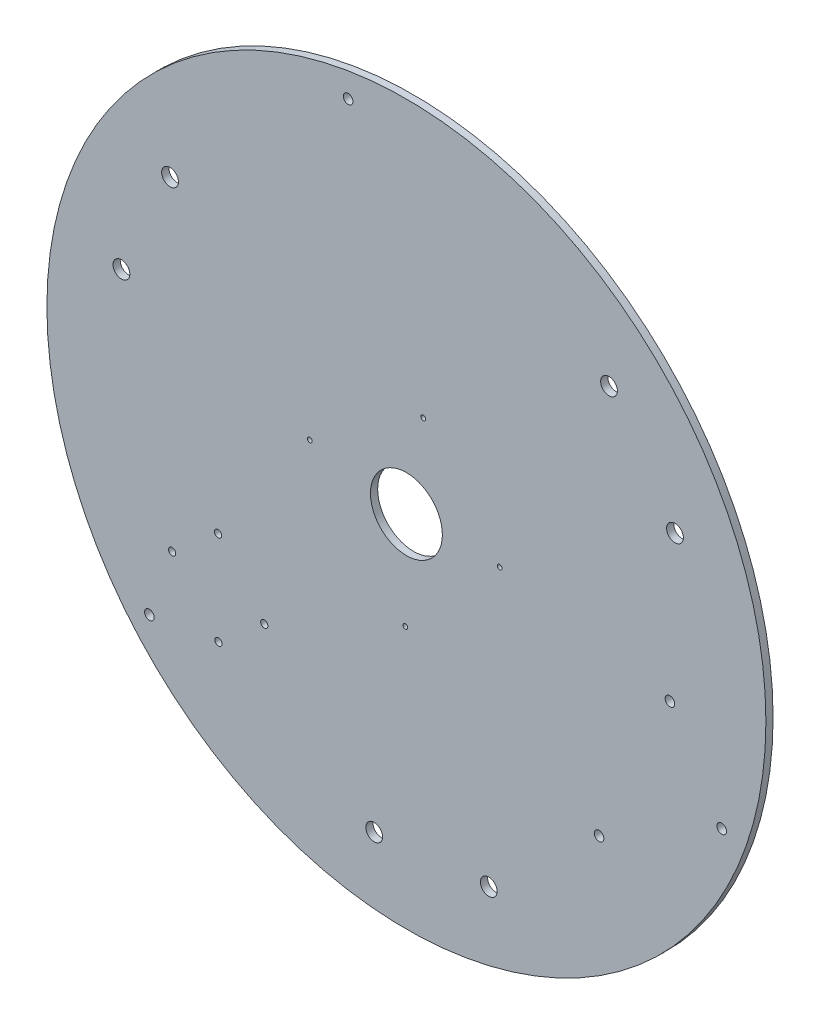
from build123d import *

# Parameters (mm, degrees)
SKETCH1_R           = 150
BOSS_EXTRUDE1_DEPTH = 3
SKETCH2_R           = 3.5
CUT_EXTRUDE1_DEPTH  = 3
CIRPATTERN1_COUNT   = 3
SKETCH3_R           = 2
CUT_EXTRUDE2_DEPTH  = 3
SKETCH4_R           = 15
CUT_EXTRUDE3_DEPTH  = 3
SKETCH5_R           = 1
CUT_EXTRUDE4_DEPTH  = 3
SKETCH6_R           = 1.5
CUT_EXTRUDE5_DEPTH  = 3
SKETCH7_R           = 2
CUT_EXTRUDE6_DEPTH  = 3
CIRPATTERN2_COUNT   = 3


with BuildPart() as part:
    # Sketch1 → Boss-Extrude1 (new body)
    with BuildSketch(Plane.XY):
        Circle(SKETCH1_R)
    extrude(amount=BOSS_EXTRUDE1_DEPTH)

    # Sketch2 → Cut-Extrude1 (cut)
    with BuildSketch(Plane(origin=(0, 0, 0), x_dir=(-1, 0, 0), z_dir=(0, 0, -1))):
        with Locations((-84.532410842, 88.488821425)):
            Circle(SKETCH2_R)
        with Locations(Location((-112.064079787, 49.169523299, 0), (0, 0, 180))):
            Circle(SKETCH2_R)
    cut_extrude1 = extrude(amount=-CUT_EXTRUDE1_DEPTH, mode=Mode.SUBTRACT)

    # CirPattern1: Cut-Extrude1 ×3 about axis
    cirpattern1_axis = Axis((0, 0, 0), (0, 0, 1))
    for i in range(1, CIRPATTERN1_COUNT):
        add(cut_extrude1.rotate(cirpattern1_axis, i * 360 / CIRPATTERN1_COUNT), mode=Mode.SUBTRACT)

    # Sketch3 → Cut-Extrude2 (cut)
    with BuildSketch(Plane(origin=(0, 0, 0), x_dir=(-1, 0, 0), z_dir=(0, 0, -1))):
        with Locations((-109.9539568, -12.654144936)):
            Circle(SKETCH3_R)
        with Locations((-80.370678478, -76.095690029)):
            Circle(SKETCH3_R)
    extrude(amount=-CUT_EXTRUDE2_DEPTH, mode=Mode.SUBTRACT)

    # Sketch4 → Cut-Extrude3 (cut)
    with BuildSketch(Plane(origin=(0, 0, 0), x_dir=(-1, 0, 0), z_dir=(0, 0, -1))):
        Circle(SKETCH4_R)
    extrude(amount=-CUT_EXTRUDE3_DEPTH, mode=Mode.SUBTRACT)

    # Sketch5 → Cut-Extrude4 (cut)
    with BuildSketch(Plane(origin=(0, 0, 0), x_dir=(-1, 0, 0), z_dir=(0, 0, -1))):
        with Locations((0.451473383, -40.846457118)):
            Circle(SKETCH5_R)
        with Locations((-38.922466014, 0.285726101)):
            Circle(SKETCH5_R)
        with Locations((40.304305183, 6.648298355)):
            Circle(SKETCH5_R)
        with Locations((-7.040200573, 38.28153048)):
            Circle(SKETCH5_R)
    extrude(amount=-CUT_EXTRUDE4_DEPTH, mode=Mode.SUBTRACT)

    # Sketch6 → Cut-Extrude5 (cut)
    with BuildSketch(Plane(origin=(0, 0, 0), x_dir=(-1, 0, 0), z_dir=(0, 0, -1))):
        with Locations((59.302185735, -69.341551519)):
            Circle(SKETCH6_R)
        with Locations((78.453296813, -85.411241761)):
            Circle(SKETCH6_R)
        with Locations((97.736925104, -62.429908467)):
            Circle(SKETCH6_R)
        with Locations((78.585814026, -46.360218225)):
            Circle(SKETCH6_R)
    extrude(amount=-CUT_EXTRUDE5_DEPTH, mode=Mode.SUBTRACT)

    # Sketch7 → Cut-Extrude6 (cut)
    with BuildSketch(Plane(origin=(0, 0, 0), x_dir=(-1, 0, 0), z_dir=(0, 0, -1))):
        with Locations((107.246222037, -89.990265356)):
            Circle(SKETCH7_R)
    cut_extrude6 = extrude(amount=-CUT_EXTRUDE6_DEPTH, mode=Mode.SUBTRACT)

    # CirPattern2: Cut-Extrude6 ×3 about axis
    cirpattern2_axis = Axis((0, 0, 0), (0, 0, 1))
    for i in range(1, CIRPATTERN2_COUNT):
        add(cut_extrude6.rotate(cirpattern2_axis, i * 360 / CIRPATTERN2_COUNT), mode=Mode.SUBTRACT)


solid = part.part
